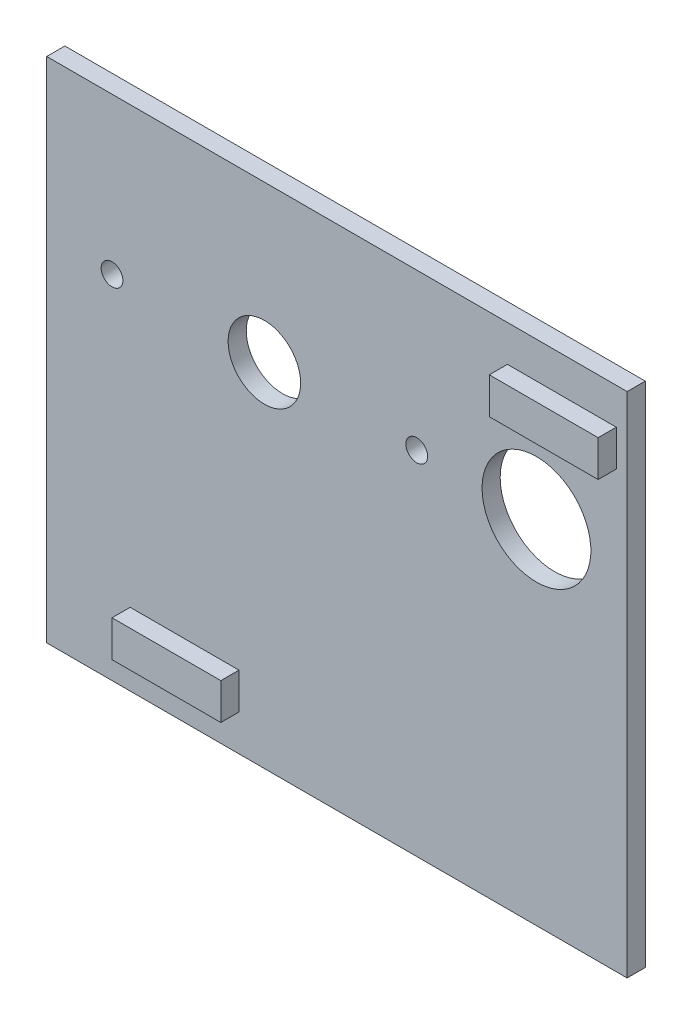
from build123d import *

# Parameters (mm, degrees)
SKETCH1_W           = 160
SKETCH1_H           = 140
BOSS_EXTRUDE1_DEPTH = 5
SKETCH2_W           = 30
SKETCH2_H           = 10
BOSS_EXTRUDE2_DEPTH = 5
SKETCH4_R           = 3
SKETCH4_R_2         = 10
SKETCH4_R_3         = 15
CUT_EXTRUDE1_DEPTH  = 15


with BuildPart() as part:
    # Sketch1 → Boss-Extrude1 (new body)
    with BuildSketch(Plane.XY):
        with Locations((-80, -70)):
            Rectangle(SKETCH1_W, SKETCH1_H)
    extrude(amount=BOSS_EXTRUDE1_DEPTH)

    # Sketch2 → Boss-Extrude2 (add)
    with BuildSketch(Plane.XY.offset(5)):
        with Locations((-18, -15)):
            Rectangle(SKETCH2_W, SKETCH2_H)
        with Locations((-122, -125)):
            Rectangle(SKETCH2_W, SKETCH2_H)
    extrude(amount=BOSS_EXTRUDE2_DEPTH)

    # Sketch4 → Cut-Extrude1 (cut)
    with BuildSketch(Plane.XY.offset(10)):
        with Locations(Location((-142, -43, 0), (0, 0, 180))):
            Circle(SKETCH4_R)
        with Locations(Location((-100, -43, 0), (0, 0, 180))):
            Circle(SKETCH4_R_2)
        with Locations(Location((-58, -43, 0), (0, 0, 180))):
            Circle(SKETCH4_R)
        with Locations(Location((-25, -43, 0), (0, 0, 180))):
            Circle(SKETCH4_R_3)
    extrude(amount=-CUT_EXTRUDE1_DEPTH, mode=Mode.SUBTRACT)


solid = part.part
